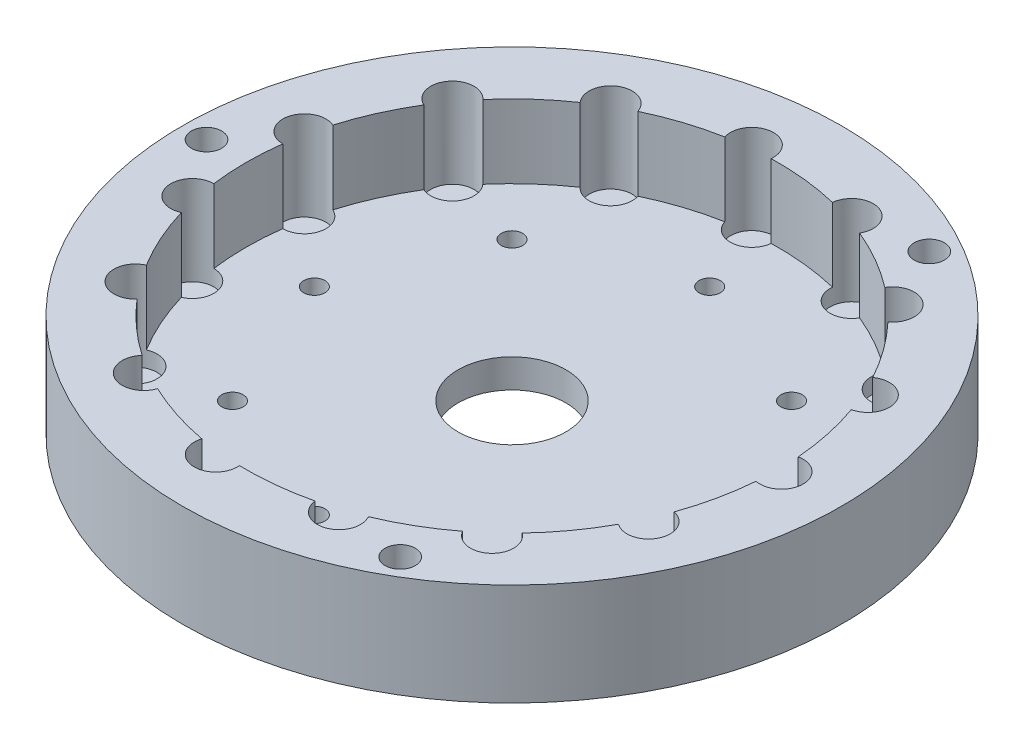
from build123d import *

# Parameters (mm, degrees)
SKETCH1_R           = 45.85
SKETCH1_R_2         = 2.1
SKETCH1_R_3         = 7.5
BOSS_EXTRUDE1_DEPTH = 4
SKETCH1_6_R         = 3
SKETCH1_6_R_2       = 1.48
CUT_EXTRUDE1_DEPTH  = 2.22
BOSS_EXTRUDE2_START = 10.22
SKETCH1_7_R         = 45.85
SKETCH1_7_R_2       = 2.1
BOSS_EXTRUDE2_DEPTH = 10.22


with BuildPart() as part:
    # Sketch1 → Boss-Extrude1 (new body)
    with BuildSketch(Plane(origin=(0, 0, 0), x_dir=(1, 0, 0), z_dir=(0, 1, 0))):
        Circle(SKETCH1_R)
        with Locations((-42.5, 0)):
            Circle(SKETCH1_R_2, mode=Mode.SUBTRACT)
        with Locations((21.25, -36.806079661)):
            Circle(SKETCH1_R_2, mode=Mode.SUBTRACT)
        with Locations((21.25, 36.806079661)):
            Circle(SKETCH1_R_2, mode=Mode.SUBTRACT)
        Circle(SKETCH1_R_3, mode=Mode.SUBTRACT)
    extrude(amount=-BOSS_EXTRUDE1_DEPTH)

    # Sketch1<6> → Cut-Extrude1 (cut)
    with BuildSketch(Plane(origin=(0, 0, 0), x_dir=(1, 0, 0), z_dir=(0, 1, 0))):
        with Locations((37.5, 0)):
            Circle(SKETCH1_6_R)
        with Locations((34.257954662, 15.252624115)):
            Circle(SKETCH1_6_R)
        with Locations((34.257954662, -15.252624115)):
            Circle(SKETCH1_6_R)
        with Locations((25.092397738, 27.867930955)):
            Circle(SKETCH1_6_R)
        with Locations((25.092397738, -27.867930955)):
            Circle(SKETCH1_6_R)
        with Locations((11.588137289, 35.664619361)):
            Circle(SKETCH1_6_R)
        with Locations((11.588137289, -35.664619361)):
            Circle(SKETCH1_6_R)
        with Locations((-3.919817373, 37.294571076)):
            Circle(SKETCH1_6_R)
        with Locations((-3.919817373, -37.294571076)):
            Circle(SKETCH1_6_R)
        with Locations((-18.75, 32.475952642)):
            Circle(SKETCH1_6_R)
        with Locations((-18.75, -32.475952642)):
            Circle(SKETCH1_6_R)
        with Locations((-30.338137289, 22.041946961)):
            Circle(SKETCH1_6_R)
        with Locations((-30.338137289, -22.041946961)):
            Circle(SKETCH1_6_R)
        with Locations((-36.680535028, 7.796688406)):
            Circle(SKETCH1_6_R)
        with Locations((-36.680535028, -7.796688406)):
            Circle(SKETCH1_6_R)
        with Locations((27.5, 0)):
            Circle(SKETCH1_6_R_2)
        with Locations((19.445436483, -19.445436483)):
            Circle(SKETCH1_6_R_2)
        with Locations((0, -27.5)):
            Circle(SKETCH1_6_R_2)
        with Locations((-19.445436483, -19.445436483)):
            Circle(SKETCH1_6_R_2)
        with Locations((-27.5, 0)):
            Circle(SKETCH1_6_R_2)
        with Locations((-19.445436483, 19.445436483)):
            Circle(SKETCH1_6_R_2)
        with Locations((0, 27.5)):
            Circle(SKETCH1_6_R_2)
        with Locations((19.445436483, 19.445436483)):
            Circle(SKETCH1_6_R_2)
    extrude(amount=-CUT_EXTRUDE1_DEPTH, mode=Mode.SUBTRACT)

    # Sketch1<7> → Boss-Extrude2 (add)
    with BuildSketch(Plane(origin=(0, 0, 0), x_dir=(1, 0, 0), z_dir=(0, 1, 0)).offset(BOSS_EXTRUDE2_START)):
        Circle(SKETCH1_7_R)
        with Locations((-42.5, 0)):
            Circle(SKETCH1_7_R_2, mode=Mode.SUBTRACT)
        with Locations((21.25, -36.806079661)):
            Circle(SKETCH1_7_R_2, mode=Mode.SUBTRACT)
        with BuildLine():
            ThreePointArc((36.883333333, 2.935936345), (39.39076704, 2.32916294), (40.5, 0))
            ThreePointArc((40.5, 0), (39.39076704, -2.32916294), (36.883333333, -2.935936345))
            ThreePointArc((36.883333333, -2.935936345), (36.191461227, -7.69273256), (34.888754523, -12.319691873))
            ThreePointArc((34.888754523, -12.319691873), (36.59166411, -13.367471546), (37.257954662, -15.252624115))
            ThreePointArc((37.257954662, -15.252624115), (35.6231437, -17.924001829), (32.500448736, -17.683914497))
            ThreePointArc((32.500448736, -17.683914497), (29.933628792, -21.748054335), (26.861593101, -25.445133446))
            ThreePointArc((26.861593101, -25.445133446), (27.767055295, -26.50917897), (28.092397738, -27.867930955))
            ThreePointArc((28.092397738, -27.867930955), (25.872343464, -30.764771418), (22.497941295, -29.37418318))
            ThreePointArc((22.497941295, -29.37418318), (18.5, -32.04293994), (14.189818202, -34.170880284))
            ThreePointArc((14.189818202, -34.170880284), (14.486847583, -34.891651942), (14.588137289, -35.664619361))
            ThreePointArc((14.588137289, -35.664619361), (11.748752331, -38.660316744), (8.605335417, -35.985388734))
            ThreePointArc((8.605335417, -35.985388734), (3.867553141, -36.797310129), (-0.935505175, -36.988171489))
            ThreePointArc((-0.935505175, -36.988171489), (-0.92374189, -37.141170608), (-0.919817373, -37.294571076))
            ThreePointArc((-0.919817373, -37.294571076), (-4.385552663, -40.258199029), (-6.775211132, -36.37439366))
            ThreePointArc((-6.775211132, -36.37439366), (-11.433628792, -35.189091103), (-15.899071208, -33.409871815))
            ThreePointArc((-15.899071208, -33.409871815), (-20.25, -35.074028853), (-20.984262125, -30.47393547))
            ThreePointArc((-20.984262125, -30.47393547), (-24.757832435, -27.496358543), (-28.113543391, -24.054701786))
            ThreePointArc((-28.113543391, -24.054701786), (-32.765188272, -23.805302718), (-31.564943561, -19.304256991))
            ThreePointArc((-31.564943561, -19.304256991), (-33.801181933, -15.049255794), (-35.466928517, -10.540255288))
            ThreePointArc((-35.466928517, -10.540255288), (-39.61497783, -8.420423478), (-36.687759497, -4.796697105))
            ThreePointArc((-36.687759497, -4.796697105), (-37, 0), (-36.687759497, 4.796697105))
            ThreePointArc((-36.687759497, 4.796697105), (-39.61497783, 8.420423478), (-35.466928517, 10.540255288))
            ThreePointArc((-35.466928517, 10.540255288), (-33.801181933, 15.049255794), (-31.564943561, 19.304256991))
            ThreePointArc((-31.564943561, 19.304256991), (-32.765188272, 23.805302718), (-28.113543391, 24.054701786))
            ThreePointArc((-28.113543391, 24.054701786), (-24.757832435, 27.496358543), (-20.984262125, 30.47393547))
            ThreePointArc((-20.984262125, 30.47393547), (-20.25, 35.074028853), (-15.899071208, 33.409871815))
            ThreePointArc((-15.899071208, 33.409871815), (-11.433628792, 35.189091103), (-6.775211132, 36.37439366))
            ThreePointArc((-6.775211132, 36.37439366), (-4.385552663, 40.258199029), (-0.919817373, 37.294571076))
            ThreePointArc((-0.919817373, 37.294571076), (-0.92374189, 37.141170608), (-0.935505175, 36.988171489))
            ThreePointArc((-0.935505175, 36.988171489), (3.867553141, 36.797310129), (8.605335417, 35.985388734))
            ThreePointArc((8.605335417, 35.985388734), (11.748752331, 38.660316744), (14.588137289, 35.664619361))
            ThreePointArc((14.588137289, 35.664619361), (14.486847583, 34.891651942), (14.189818202, 34.170880284))
            ThreePointArc((14.189818202, 34.170880284), (18.5, 32.04293994), (22.497941295, 29.37418318))
            ThreePointArc((22.497941295, 29.37418318), (25.872343464, 30.764771418), (28.092397738, 27.867930955))
            ThreePointArc((28.092397738, 27.867930955), (27.767055295, 26.50917897), (26.861593101, 25.445133446))
            ThreePointArc((26.861593101, 25.445133446), (29.933628792, 21.748054335), (32.500448736, 17.683914497))
            ThreePointArc((32.500448736, 17.683914497), (35.6231437, 17.924001829), (37.257954662, 15.252624115))
            ThreePointArc((37.257954662, 15.252624115), (36.59166411, 13.367471546), (34.888754523, 12.319691873))
            ThreePointArc((34.888754523, 12.319691873), (36.191461227, 7.69273256), (36.883333333, 2.935936345))
        make_face(mode=Mode.SUBTRACT)
        with Locations((21.25, 36.806079661)):
            Circle(SKETCH1_7_R_2, mode=Mode.SUBTRACT)
    extrude(amount=-BOSS_EXTRUDE2_DEPTH)


solid = part.part
